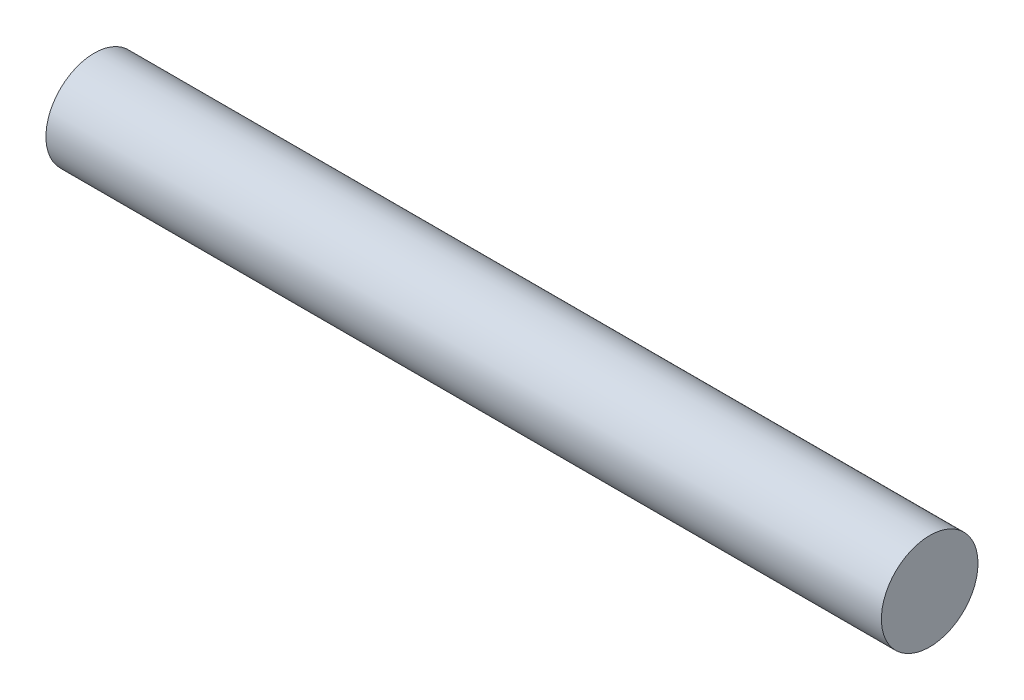
from build123d import *

# Parameters (mm, degrees)
SKETCH1_R           = 0.925
BOSS_EXTRUDE1_DEPTH = 16


with BuildPart() as part:
    # Sketch1 → Boss-Extrude1 (new body)
    with BuildSketch(Plane(origin=(0, 0, 0), x_dir=(0, 0, -1), z_dir=(1, 0, 0))):
        Circle(SKETCH1_R)
    extrude(amount=BOSS_EXTRUDE1_DEPTH)


solid = part.part
